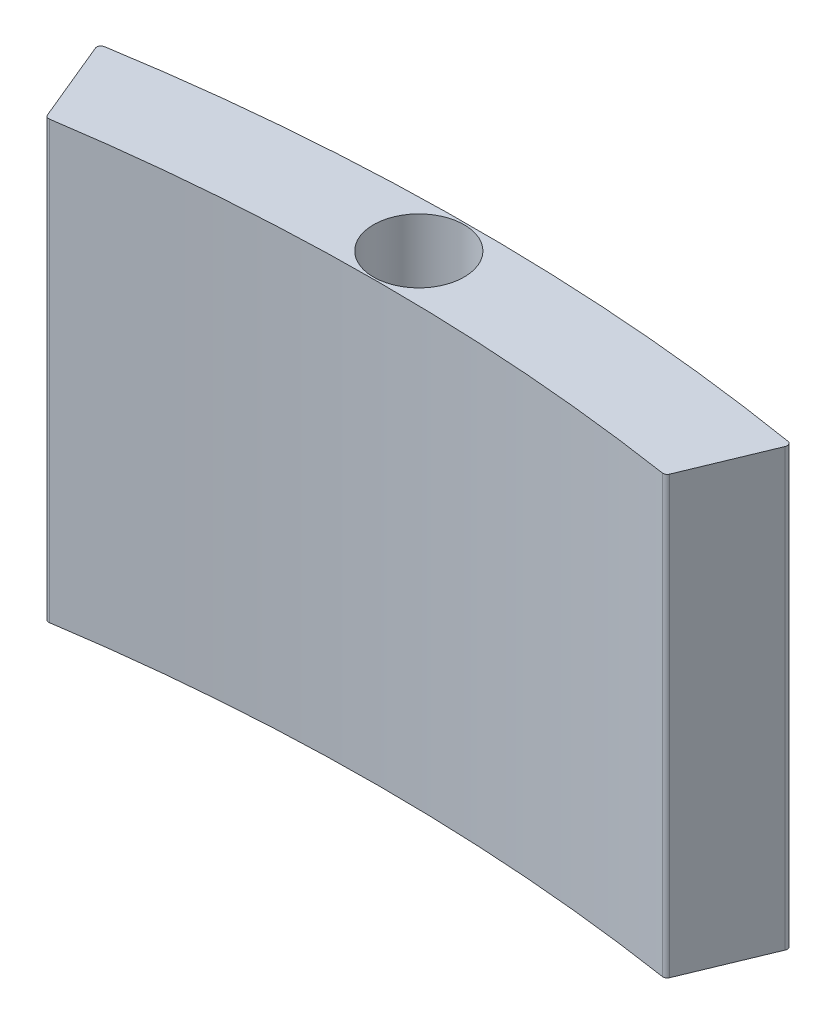
from build123d import *

# Parameters (mm, degrees)
SKETCH1_R           = 2.6
BOSS_EXTRUDE1_DEPTH = 12.5


with BuildPart() as part:
    # Sketch1 → Boss-Extrude1 (new, symmetric)
    with BuildSketch(Plane(origin=(0, 0, 0), x_dir=(1, 0, 0), z_dir=(0, 1, 0))):
        with BuildLine():
            Line((18.269584171, -2.356974332), (20.210940503, 2.329874452))
            ThreePointArc((20.210940503, 2.329874452), (20.19858704, 2.544220241), (20.022938795, 2.667688533))
            ThreePointArc((20.022938795, 2.667688533), (0.438109454, 4.261682942), (-19.146719886, 2.667688533))
            ThreePointArc((-19.146719886, 2.667688533), (-19.322368131, 2.544220241), (-19.334721594, 2.329874452))
            Line((-19.334721594, 2.329874452), (-17.393365262, -2.356974332))
            ThreePointArc((-17.393365262, -2.356974332), (-17.286501727, -2.477513642), (-17.128021481, -2.506384946))
            ThreePointArc((-17.128021481, -2.506384946), (0.438109454, -1.164961325), (18.00424039, -2.506384946))
            ThreePointArc((18.00424039, -2.506384946), (18.162720636, -2.477513642), (18.269584171, -2.356974332))
        make_face()
        with Locations(Location((0, 1.536674283, 0), (0, 0, 270))):
            Circle(SKETCH1_R, mode=Mode.SUBTRACT)
    extrude(amount=BOSS_EXTRUDE1_DEPTH, both=True)


solid = part.part
